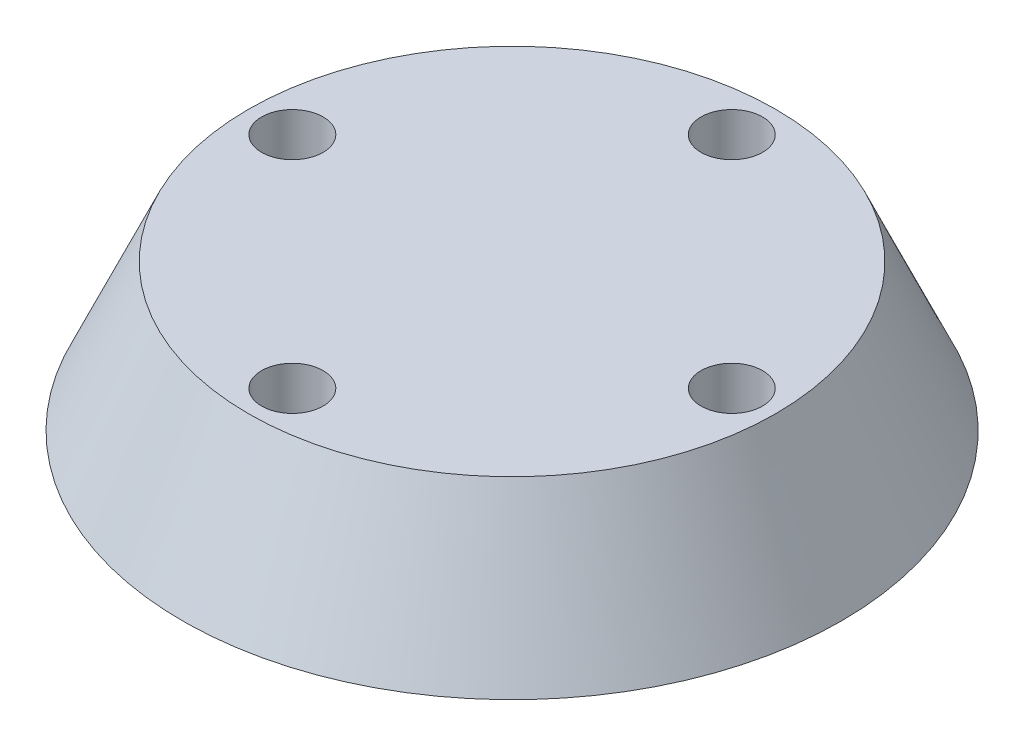
from build123d import *

# Parameters (mm, degrees)
SKETCH_26_R         = 2.1
CUT_EXTRUDE_2_DEPTH = 4
SKETCH_36_R         = 2.1
CUT_EXTRUDE_3_DEPTH = 4


with BuildPart() as part:
    # 草图8 → 旋转1 (revolve)
    with BuildSketch(Plane(origin=(0, 0, 0), x_dir=(-1, 0, 0), z_dir=(0, 0, -1))):
        Polygon((0, 0), (-18, 0), (-22.5, -10), (0, -10), align=None)
    revolve(axis=Axis((0, -10, 0), (0, 1, 0)))

    # 草图26 → 切除-拉伸2 (cut)
    with BuildSketch(Plane(origin=(0, -10, 0), x_dir=(1, 0, 0), z_dir=(0, 1, 0))):
        with Locations(Location((18, 0, 0), (0, 0, 270))):
            Circle(SKETCH_26_R)
        with Locations(Location((0, -18, 0), (0, 0, 270))):
            Circle(SKETCH_26_R)
        with Locations(Location((0, 18, 0), (0, 0, 270))):
            Circle(SKETCH_26_R)
        with Locations(Location((-18, 0, 0), (0, 0, 270))):
            Circle(SKETCH_26_R)
    extrude(amount=CUT_EXTRUDE_2_DEPTH, mode=Mode.SUBTRACT)

    # 草图36 → 切除-拉伸3 (cut)
    with BuildSketch(Plane(origin=(0, 0, 0), x_dir=(1, 0, 0), z_dir=(0, 1, 0))):
        with Locations(Location((0, 15, 0), (0, 0, 180))):
            Circle(SKETCH_36_R)
        with Locations(Location((15, 0, 0), (0, 0, 180))):
            Circle(SKETCH_36_R)
        with Locations(Location((0, -15, 0), (0, 0, 180))):
            Circle(SKETCH_36_R)
        with Locations(Location((-15, 0, 0), (0, 0, 180))):
            Circle(SKETCH_36_R)
    extrude(amount=-CUT_EXTRUDE_3_DEPTH, mode=Mode.SUBTRACT)


solid = part.part
